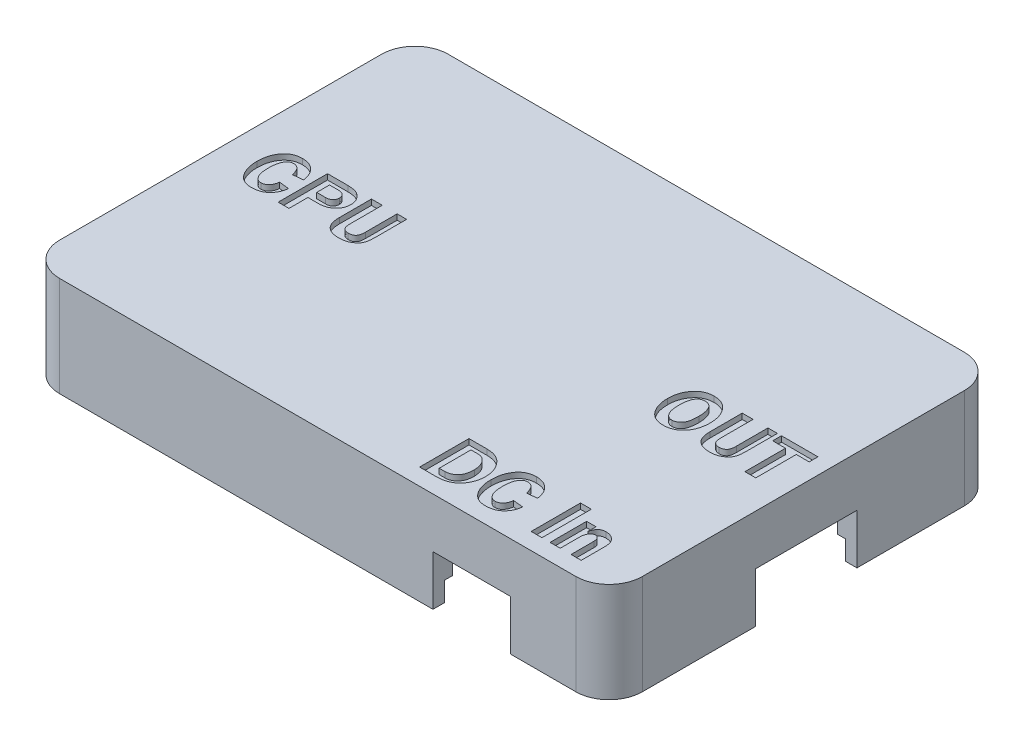
from build123d import *

# Parameters (mm, degrees)
SKETCH1_W           = 105
SKETCH1_H           = 70
BOSS_EXTRUDE1_DEPTH = 15
SKETCH3_W           = 98
SKETCH3_H           = 63
CUT_EXTRUDE1_DEPTH  = 12
FILLET1_R           = 6
SKETCH6_W           = 3.5
SKETCH6_H           = 18.3
SKETCH6_W_2         = 14
SKETCH6_H_2         = 3.5
SKETCH6_H_3         = 20
CUT_EXTRUDE3_DEPTH  = 26
CUT_EXTRUDE4_START  = -10
CUT_EXTRUDE4_DEPTH  = 10
BOSS_EXTRUDE3_DEPTH = 3
CUT_EXTRUDE5_DEPTH  = 3.5
SKETCH12_W          = 3.5
SKETCH12_H          = 18.3
SKETCH12_W_2        = 14
SKETCH12_H_2        = 3.5
SKETCH12_H_3        = 20
BOSS_EXTRUDE4_DEPTH = 6
SKETCH13_W          = 1.949036815
SKETCH13_H          = 8.892480469
CUT_EXTRUDE6_DEPTH  = 1


with BuildPart() as part:
    # Sketch1 → Boss-Extrude1 (new body)
    with BuildSketch(Plane(origin=(0, 0, 0), x_dir=(1, 0, 0), z_dir=(0, 1, 0))):
        Rectangle(SKETCH1_W, SKETCH1_H)
    extrude(amount=BOSS_EXTRUDE1_DEPTH)

    # Sketch3 → Cut-Extrude1 (cut)
    with BuildSketch(Plane(origin=(0, 15, 0), x_dir=(1, 0, 0), z_dir=(0, 1, 0))):
        Rectangle(SKETCH3_W, SKETCH3_H)
    extrude(amount=-CUT_EXTRUDE1_DEPTH, mode=Mode.SUBTRACT)

    # Fillet1
    fillet1_edges = [part.edges().sort_by_distance(p)[0] for p in [
        (-49, 9, 31.5),
        (-49, 9, -31.5),
        (49, 9, -31.5),
        (49, 9, 31.5),
        (52.5, 7.5, 35),
        (-52.5, 7.5, 35),
        (-52.5, 7.5, -35),
        (52.5, 7.5, -35),
    ]]
    fillet(fillet1_edges, radius=FILLET1_R)

    # Sketch6 → Cut-Extrude3 (cut)
    with BuildSketch(Plane(origin=(0, 15, 0), x_dir=(1, 0, 0), z_dir=(0, 1, 0))):
        with Locations((50.75, 0.51)):
            Rectangle(SKETCH6_W, SKETCH6_H)
        with Locations((27.76, -33.25)):
            Rectangle(SKETCH6_W_2, SKETCH6_H_2)
        with Locations((-50.75, 0)):
            Rectangle(SKETCH6_W, SKETCH6_H_3)
    extrude(amount=-CUT_EXTRUDE3_DEPTH, mode=Mode.SUBTRACT)

    # Sketch9 → Cut-Extrude4 (cut)
    with BuildSketch(Plane(origin=(0, 3, 0), x_dir=(1, 0, 0), z_dir=(0, 1, 0)).offset(CUT_EXTRUDE4_START)):
        with BuildLine():
            Line((-43, 31.5), (43, 31.5))
            ThreePointArc((43, 31.5), (47.242640687, 29.742640687), (49, 25.5))
            Line((49, 25.5), (49, -25.5))
            ThreePointArc((49, -25.5), (47.242640687, -29.742640687), (43, -31.5))
            Line((43, -31.5), (-43, -31.5))
            ThreePointArc((-43, -31.5), (-47.242640687, -29.742640687), (-49, -25.5))
            Line((-49, -25.5), (-49, 25.5))
            ThreePointArc((-49, 25.5), (-47.242640687, 29.742640687), (-43, 31.5))
        make_face()
    extrude(amount=CUT_EXTRUDE4_DEPTH, mode=Mode.SUBTRACT)


with BuildPart() as cut_extrude4_piece_1:
    # of the separate pieces the step leaves, piece 1, a body of its own (cut_extrude4_pieces)
    add(part.part.solids().sort_by_distance((-46.5, 0, -35))[0])

    # Sketch10 → Boss-Extrude3 (add)
    with BuildSketch(Plane(origin=(0, 15, 0), x_dir=(1, 0, 0), z_dir=(0, 1, 0))):
        with BuildLine():
            Line((-46.5, 35), (46.5, 35))
            ThreePointArc((46.5, 35), (50.742640687, 33.242640687), (52.5, 29))
            Line((52.5, 29), (52.5, -29))
            ThreePointArc((52.5, -29), (50.742640687, -33.242640687), (46.5, -35))
            Line((46.5, -35), (-46.5, -35))
            ThreePointArc((-46.5, -35), (-50.742640687, -33.242640687), (-52.5, -29))
            Line((-52.5, -29), (-52.5, 29))
            ThreePointArc((-52.5, 29), (-50.742640687, 33.242640687), (-46.5, 35))
        make_face()
    extrude(amount=BOSS_EXTRUDE3_DEPTH)


with BuildPart() as cut_extrude4_piece_2:
    # of the separate pieces the step leaves, piece 2, a body of its own (cut_extrude4_pieces)
    add(part.part.solids().sort_by_distance((-52.5, 0, 10))[0])


with BuildPart() as cut_extrude4_piece_3:
    # of the separate pieces the step leaves, piece 3, a body of its own (cut_extrude4_pieces)
    add(part.part.solids().sort_by_distance((49, 0, 8.64))[0])


with BuildPart() as cut_extrude5_tool:
    # Sketch11 → Cut-Extrude5 (new body)
    with BuildSketch(Plane(origin=(0, 0, 0), x_dir=(-1, 0, 0), z_dir=(0, -1, 0))):
        with BuildLine():
            Line((-44.4, 32.9), (44.4, 32.9))
            ThreePointArc((44.4, 32.9), (48.642640687, 31.142640687), (50.4, 26.9))
            Line((50.4, 26.9), (50.4, -26.9))
            ThreePointArc((50.4, -26.9), (48.642640687, -31.142640687), (44.4, -32.9))
            Line((44.4, -32.9), (-44.4, -32.9))
            ThreePointArc((-44.4, -32.9), (-48.642640687, -31.142640687), (-50.4, -26.9))
            Line((-50.4, -26.9), (-50.4, 26.9))
            ThreePointArc((-50.4, 26.9), (-48.642640687, 31.142640687), (-44.4, 32.9))
        make_face()
    extrude(amount=-CUT_EXTRUDE5_DEPTH)


with BuildPart() as cut_extrude4_piece_1_1:
    add(cut_extrude4_piece_1.part)

    # Cut-Extrude5: cut by cut_extrude5_tool
    add(cut_extrude5_tool.part, mode=Mode.SUBTRACT)



with BuildPart() as cut_extrude4_piece_2_1:
    add(cut_extrude4_piece_2.part)

    # Cut-Extrude5: cut by cut_extrude5_tool
    add(cut_extrude5_tool.part, mode=Mode.SUBTRACT)


with BuildPart() as cut_extrude4_piece_3_1:
    add(cut_extrude4_piece_3.part)

    # Cut-Extrude5: cut by cut_extrude5_tool
    add(cut_extrude5_tool.part, mode=Mode.SUBTRACT)


with BuildPart() as cut_extrude4_piece_1_2:
    add(cut_extrude4_piece_1_1.part)

    add(cut_extrude4_piece_2_1.part)  # Boss-Extrude4 merges Cut-Extrude4 piece 2

    add(cut_extrude4_piece_3_1.part)  # Boss-Extrude4 merges Cut-Extrude4 piece 3
    # Sketch12 → Boss-Extrude4 (add)
    with BuildSketch(Plane(origin=(0, 15, 0), x_dir=(-1, 0, 0), z_dir=(0, -1, 0))):
        with Locations((-50.75, 0.51)):
            Rectangle(SKETCH12_W, SKETCH12_H)
        with Locations((-27.76, -33.25)):
            Rectangle(SKETCH12_W_2, SKETCH12_H_2)
        with Locations((50.75, 0)):
            Rectangle(SKETCH12_W, SKETCH12_H_3)
    extrude(amount=BOSS_EXTRUDE4_DEPTH)

    # Sketch13 → Cut-Extrude6 (cut)
    # profile 1 of 10: a face of its own
    with BuildSketch(Plane(origin=(0, 18, 0), x_dir=(1, 0, 0), z_dir=(0, 1, 0))):
        with BuildLine():
            Line((-41.732830518, -0.163303105), (-39.917028641, -0.347928662))
            add(Edge.make_bspline(
                [(-39.917028641, -0.347928662), (-39.930917153, -0.462457061), (-39.958267714, -0.687997137), (-40.032669671, -1.015962513), (-40.125941255, -1.329682055), (-40.249006157, -1.62526642), (-40.39454952, -1.904547154), (-40.56156911, -2.169478809), (-40.758028769, -2.414563659), (-40.973277238, -2.645844177), (-41.213243183, -2.852206272), (-41.471426508, -3.03544519), (-41.751318919, -3.188356125), (-42.051270543, -3.311193555), (-42.369744507, -3.409093428), (-42.70739142, -3.47890595), (-43.064710699, -3.521653823), (-43.309321878, -3.526141638), (-43.434431019, -3.528436981)],
                knots=[0, 0, 0, 0, 1.051982192, 2.07166211, 3.064163433, 4.034902158, 4.987714795, 5.935166584, 6.887152378, 7.84950099, 8.813936601, 9.76952359, 10.733246651, 11.716896322, 12.722162435, 13.768923523, 14.858890826, 16, 16, 16, 16], degree=3))
            add(Edge.make_bspline(
                [(-43.434431019, -3.528436981), (-43.534732181, -3.52663117), (-43.730683014, -3.523103293), (-44.017260625, -3.494966954), (-44.288482465, -3.444281158), (-44.547091665, -3.379147308), (-44.789920324, -3.291038408), (-45.019446117, -3.186279485), (-45.23307208, -3.059675873), (-45.433501465, -2.914689034), (-45.618917592, -2.752340761), (-45.79410872, -2.577726971), (-45.956655035, -2.389407229), (-46.110753006, -2.188898721), (-46.249835335, -1.972936805), (-46.383522408, -1.746635103), (-46.499203107, -1.503835094), (-46.609270671, -1.251484992), (-46.702215045, -0.987358923), (-46.787514337, -0.717593866), (-46.855359809, -0.439402645), (-46.911850934, -0.155453199), (-46.958457647, 0.135192666), (-46.990201698, 0.431870317), (-47.009988286, 0.735441201), (-47.011816273, 0.939978141), (-47.012740796, 1.043424767)],
                knots=[0, 0, 0, 0, 1.105609578, 2.159946219, 3.169608684, 4.145018578, 5.096309205, 6.013193973, 6.922417586, 7.828974177, 8.736285872, 9.636371327, 10.553549476, 11.476787637, 12.421499323, 13.383578628, 14.372015653, 15.3840493, 16.417202389, 17.456939369, 18.501862101, 19.571742627, 20.648005113, 21.745532771, 22.859780399, 24, 24, 24, 24], degree=3))
            add(Edge.make_bspline(
                [(-47.012740796, 1.043424767), (-47.009932604, 1.207219444), (-47.004435413, 1.527856552), (-46.958042653, 1.997342331), (-46.881812604, 2.443684033), (-46.778760792, 2.86849661), (-46.640131777, 3.26881264), (-46.47618975, 3.648246316), (-46.275301654, 4.001305531), (-46.051605893, 4.332279318), (-45.798482326, 4.631074101), (-45.522259605, 4.894979009), (-45.219088123, 5.114582299), (-44.894333995, 5.294942801), (-44.547918429, 5.437692328), (-44.177139344, 5.53471243), (-43.784956584, 5.598557477), (-43.515268986, 5.604588413), (-43.377330331, 5.60767309)],
                knots=[0, 0, 0, 0, 1.198178484, 2.345500427, 3.447453775, 4.509103708, 5.539599216, 6.543499879, 7.528638035, 8.507148543, 9.462269331, 10.388250012, 11.295364851, 12.193024101, 13.10070884, 14.028537591, 14.991644863, 16, 16, 16, 16], degree=3))
            add(Edge.make_bspline(
                [(-43.377330331, 5.60767309), (-43.261729359, 5.605291777), (-43.035519123, 5.600631978), (-42.704593927, 5.558922333), (-42.389019283, 5.495287921), (-42.089197625, 5.404004265), (-41.805543882, 5.285197042), (-41.537573682, 5.139986285), (-41.285849643, 4.967463774), (-41.049073053, 4.771598492), (-40.831345208, 4.549881529), (-40.634737113, 4.303786455), (-40.461664548, 4.032853249), (-40.306662366, 3.741362563), (-40.174802034, 3.42530312), (-40.068364943, 3.085076327), (-39.976704918, 2.723267558), (-39.937225575, 2.471974286), (-39.917028641, 2.343417096)],
                knots=[0, 0, 0, 0, 1.053980237, 2.062449089, 3.037335328, 3.987379173, 4.915943175, 5.837774954, 6.762291017, 7.69511876, 8.636291522, 9.591555379, 10.562673013, 11.564478635, 12.599430281, 13.681008754, 14.813645119, 16, 16, 16, 16], degree=3))
            Line((-39.917028641, 2.343417096), (-41.719507024, 2.16830832))
            add(Edge.make_bspline(
                [(-41.719507024, 2.16830832), (-41.736745597, 2.243295967), (-41.770365768, 2.389543423), (-41.828054355, 2.600437285), (-41.896476854, 2.795914467), (-41.966482073, 2.978298982), (-42.047911885, 3.144645262), (-42.133057486, 3.298005699), (-42.225547815, 3.436523697), (-42.325614164, 3.560154242), (-42.432581609, 3.668512163), (-42.544805142, 3.765097336), (-42.665242989, 3.84509415), (-42.792428335, 3.910442221), (-42.925627517, 3.962085469), (-43.066096105, 3.998523334), (-43.21301588, 4.019324513), (-43.313186247, 4.022479846), (-43.364006837, 4.024080678)],
                knots=[0, 0, 0, 0, 1.364641525, 2.661443042, 3.874868095, 5.036638674, 6.123695894, 7.156520859, 8.145828854, 9.073718286, 9.972847736, 10.84306696, 11.695053518, 12.530457183, 13.374680603, 14.223466012, 15.098690498, 16, 16, 16, 16], degree=3))
            add(Edge.make_bspline(
                [(-43.364006837, 4.024080678), (-43.42065862, 4.021970895), (-43.532490648, 4.017806132), (-43.695947217, 3.982029648), (-43.852338294, 3.925026032), (-43.998896501, 3.841823648), (-44.138472783, 3.737079286), (-44.268888335, 3.609250764), (-44.391958259, 3.4585958), (-44.505695436, 3.285275317), (-44.609015513, 3.087959196), (-44.697538373, 2.866363635), (-44.77351781, 2.621293507), (-44.836270516, 2.352319635), (-44.882663061, 2.0583307), (-44.91644816, 1.740059625), (-44.937432299, 1.397727548), (-44.940372742, 1.161463576), (-44.94188918, 1.039618055)],
                knots=[0, 0, 0, 0, 0.726895696, 1.434910162, 2.138785806, 2.857458904, 3.590857252, 4.374590525, 5.196778853, 6.085005742, 7.032695212, 8.052607015, 9.145406711, 10.325446451, 11.59680084, 12.965544286, 14.435077357, 16, 16, 16, 16], degree=3))
            add(Edge.make_bspline(
                [(-44.94188918, 1.039618055), (-44.940578125, 0.915857434), (-44.938041018, 0.676360443), (-44.91441178, 0.330272506), (-44.879511011, 0.009235585), (-44.828554722, -0.286517707), (-44.76241344, -0.557671046), (-44.681612082, -0.803991335), (-44.584113346, -1.024302606), (-44.473945063, -1.219572559), (-44.351514645, -1.389711452), (-44.221270317, -1.536745034), (-44.087189078, -1.664095498), (-43.944110177, -1.765349665), (-43.797167205, -1.848088065), (-43.640910632, -1.90199032), (-43.479279519, -1.938755502), (-43.368657202, -1.942797103), (-43.312616218, -1.944844569)],
                knots=[0, 0, 0, 0, 1.578182673, 3.054040949, 4.422086023, 5.695161059, 6.87854739, 7.978818638, 8.996746236, 9.946184514, 10.833196196, 11.664422499, 12.448801434, 13.185309597, 13.895016738, 14.591171581, 15.286291109, 16, 16, 16, 16], degree=3))
            add(Edge.make_bspline(
                [(-43.312616218, -1.944844569), (-43.261779857, -1.943381015), (-43.160857469, -1.940475508), (-43.012690293, -1.917345105), (-42.869908081, -1.878604153), (-42.732950683, -1.825801984), (-42.601517568, -1.755926786), (-42.476839521, -1.670501033), (-42.357682166, -1.569750796), (-42.24384158, -1.456748463), (-42.139970504, -1.329363593), (-42.046375233, -1.191805045), (-41.963701534, -1.044248772), (-41.894446476, -0.886413172), (-41.8336842, -0.71968569), (-41.790401322, -0.542481149), (-41.751792821, -0.356818708), (-41.73925146, -0.22883061), (-41.732830518, -0.163303105)],
                knots=[0, 0, 0, 0, 0.929161302, 1.844608371, 2.733809141, 3.629943943, 4.52246771, 5.449091207, 6.387761928, 7.372056715, 8.377585556, 9.387853863, 10.410894549, 11.465029895, 12.536385021, 13.650531068, 14.797115969, 16, 16, 16, 16], degree=3))
        make_face()
    # profile 2 of 10: a face of its own
    with BuildSketch(Plane(origin=(0, 18, 0), x_dir=(1, 0, 0), z_dir=(0, 1, 0))):
        with BuildLine():
            Line((-36.780297517, -3.40662218), (-38.729334332, -3.40662218))
            Line((-38.729334332, -3.40662218), (-38.729334332, 5.485858289))
            Line((-38.729334332, 5.485858289), (-35.034919822, 5.485858289))
            add(Edge.make_bspline(
                [(-35.034919822, 5.485858289), (-34.900329644, 5.483291664), (-34.640097774, 5.478329063), (-34.263170573, 5.440549118), (-33.913759563, 5.375881986), (-33.590427465, 5.288054474), (-33.29537958, 5.170919097), (-33.026458728, 5.03080972), (-32.786431732, 4.861750281), (-32.575390422, 4.668259387), (-32.390752935, 4.459881724), (-32.228950298, 4.242751332), (-32.091332188, 4.019036297), (-31.980827182, 3.786253148), (-31.89127879, 3.548031598), (-31.832273656, 3.301081416), (-31.79104414, 3.047773742), (-31.787623769, 2.875893577), (-31.785890679, 2.788802462)],
                knots=[0, 0, 0, 0, 1.359773363, 2.629139583, 3.822342582, 4.946838289, 6.008686318, 7.023819875, 8.003792892, 8.965842641, 9.910259963, 10.812871024, 11.699009655, 12.559192182, 13.413045169, 14.265067297, 15.120915298, 16, 16, 16, 16], degree=3))
            add(Edge.make_bspline(
                [(-31.785890679, 2.788802462), (-31.788284608, 2.690310132), (-31.792969624, 2.497556685), (-31.834763372, 2.21455774), (-31.900030871, 1.944331099), (-31.994968217, 1.686961865), (-32.113812788, 1.441721632), (-32.265894407, 1.212721631), (-32.437852732, 0.992576503), (-32.63810002, 0.790198973), (-32.858414365, 0.605775697), (-33.096212559, 0.443201696), (-33.350871837, 0.308163623), (-33.620450405, 0.196713504), (-33.905131788, 0.108950017), (-34.206314183, 0.04965203), (-34.521816848, 0.009206231), (-34.737862033, 0.005889228), (-34.848390908, 0.004192247)],
                knots=[0, 0, 0, 0, 1.018665852, 1.993569996, 2.953750447, 3.890480617, 4.827118752, 5.766766339, 6.729569352, 7.713802092, 8.706559697, 9.698991611, 10.688814147, 11.683718633, 12.713787737, 13.765739752, 14.856950822, 16, 16, 16, 16], degree=3))
            Line((-34.848390908, 0.004192247), (-36.780297517, 0.004192247))
            Line((-36.780297517, 0.004192247), (-36.780297517, -3.40662218))
        make_face()
        with BuildLine():
            Line((-36.780297517, 1.587784659), (-35.200511817, 1.587784659))
            add(Edge.make_bspline(
                [(-35.200511817, 1.587784659), (-35.096161166, 1.590845836), (-34.898880973, 1.596633148), (-34.622545597, 1.655006664), (-34.386308533, 1.754258799), (-34.191154669, 1.893177938), (-34.040696971, 2.068052663), (-33.931083456, 2.270887131), (-33.867767733, 2.502115414), (-33.860502284, 2.664694578), (-33.856742295, 2.74883198)],
                knots=[0, 0, 0, 0, 1.241541437, 2.347196968, 3.342370143, 4.273487896, 5.173422332, 6.065966554, 6.999105747, 8, 8, 8, 8], degree=3))
            add(Edge.make_bspline(
                [(-33.856742295, 2.74883198), (-33.859973563, 2.826022998), (-33.866272025, 2.976485509), (-33.92842841, 3.193144344), (-34.028464557, 3.391434996), (-34.143651384, 3.540038643), (-34.255988454, 3.648202354), (-34.362111828, 3.715728634), (-34.484275202, 3.772347313), (-34.621696941, 3.823440974), (-34.77825575, 3.856926834), (-34.950334664, 3.884435134), (-35.139370335, 3.89871296), (-35.270917626, 3.901048833), (-35.339456825, 3.902265877)],
                knots=[0, 0, 0, 0, 1.294039653, 2.522371889, 3.752136745, 5.005688589, 5.661752901, 6.36236276, 7.106073407, 7.921965867, 8.819093097, 9.789867873, 10.848469742, 12, 12, 12, 12], degree=3))
            Line((-35.339456825, 3.902265877), (-36.780297517, 3.902265877))
            Line((-36.780297517, 3.902265877), (-36.780297517, 1.587784659))
        make_face(mode=Mode.SUBTRACT)
    # profile 3 of 10: a face of its own
    with BuildSketch(Plane(origin=(0, 18, 0), x_dir=(1, 0, 0), z_dir=(0, 1, 0))):
        with BuildLine():
            Line((-24.477002622, 5.485858289), (-24.477002622, -0.18614338))
            add(Edge.make_bspline(
                [(-24.477002622, -0.18614338), (-24.477741403, -0.277513396), (-24.479178532, -0.455252924), (-24.490052633, -0.71435412), (-24.511119023, -0.957486067), (-24.539560185, -1.185464326), (-24.575327961, -1.397646505), (-24.617957673, -1.594510543), (-24.672394661, -1.77459257), (-24.732595119, -1.942049036), (-24.806409808, -2.099803377), (-24.895916912, -2.25054975), (-25.004005413, -2.395114638), (-25.125586346, -2.536888256), (-25.265969774, -2.672143742), (-25.422396894, -2.802906112), (-25.593864999, -2.931147781), (-25.781482394, -3.051861033), (-25.98156498, -3.164224985), (-26.195019602, -3.261529071), (-26.41849019, -3.345731445), (-26.654560892, -3.411222912), (-26.899522285, -3.465762767), (-27.156803038, -3.50033579), (-27.424208786, -3.524394485), (-27.60669801, -3.527075358), (-27.699384778, -3.528436981)],
                knots=[0, 0, 0, 0, 1.232909519, 2.398344302, 3.498197176, 4.525023179, 5.49755951, 6.401064252, 7.240745329, 8.0343409, 8.800303383, 9.58726796, 10.39545972, 11.233043339, 12.104842021, 13.022312987, 13.98286845, 14.992091959, 16.030663636, 17.076443674, 18.154591772, 19.249401951, 20.379492449, 21.538147082, 22.749618276, 24, 24, 24, 24], degree=3))
            add(Edge.make_bspline(
                [(-27.699384778, -3.528436981), (-27.787615712, -3.527580763), (-27.960487633, -3.525903164), (-28.213879165, -3.505710903), (-28.456209268, -3.476449577), (-28.686165609, -3.432320086), (-28.905133189, -3.3773809), (-29.111754964, -3.309016847), (-29.307441888, -3.229092173), (-29.490174312, -3.136094501), (-29.659374052, -3.030340747), (-29.818468495, -2.918215263), (-29.965302836, -2.796510842), (-30.099208786, -2.664838602), (-30.219468435, -2.522896512), (-30.328054662, -2.372938781), (-30.423712463, -2.213522808), (-30.508073306, -2.045052565), (-30.580123734, -1.866030613), (-30.640768652, -1.67542625), (-30.694029198, -1.47417429), (-30.738083779, -1.261414004), (-30.769173208, -1.036819269), (-30.794980727, -0.802081454), (-30.807191665, -0.55488566), (-30.809954969, -0.386638764), (-30.811372271, -0.300344756)],
                knots=[0, 0, 0, 0, 1.232927142, 2.415688846, 3.550816513, 4.643046955, 5.686186614, 6.704144379, 7.682352101, 8.638155303, 9.56594428, 10.468992341, 11.356891567, 12.228522285, 13.090353992, 13.954236325, 14.813509306, 15.685996709, 16.585117507, 17.50776422, 18.480004747, 19.493937418, 20.542378439, 21.648026349, 22.79367027, 24, 24, 24, 24], degree=3))
            Line((-30.811372271, -0.300344756), (-30.811372271, 5.485858289))
            Line((-30.811372271, 5.485858289), (-28.862335456, 5.485858289))
            Line((-28.862335456, 5.485858289), (-28.862335456, -0.205176943))
            add(Edge.make_bspline(
                [(-28.862335456, -0.205176943), (-28.861546891, -0.294674904), (-28.860046021, -0.465015718), (-28.840590718, -0.707784768), (-28.810764574, -0.925274724), (-28.770651113, -1.118260743), (-28.715228073, -1.285406559), (-28.649365022, -1.428427242), (-28.5700854, -1.54693481), (-28.445960354, -1.665174178), (-28.275579665, -1.776262538), (-28.057789208, -1.872047073), (-27.82786451, -1.935055278), (-27.669340603, -1.941551732), (-27.588990115, -1.944844569)],
                knots=[0, 0, 0, 0, 1.299600879, 2.473520833, 3.534320362, 4.486853006, 5.331918955, 6.08625075, 6.768716594, 7.387765943, 8.563420649, 9.70209071, 10.835266329, 12, 12, 12, 12], degree=3))
            add(Edge.make_bspline(
                [(-27.588990115, -1.944844569), (-27.486514257, -1.940539687), (-27.290740938, -1.932315496), (-27.012148006, -1.867874997), (-26.768713164, -1.754942932), (-26.588648911, -1.627830029), (-26.468664192, -1.49539878), (-26.390373421, -1.373999959), (-26.325916981, -1.230631372), (-26.273439468, -1.06637421), (-26.232217497, -0.880945671), (-26.201865937, -0.674900922), (-26.185438347, -0.44717332), (-26.183450292, -0.288315713), (-26.182409835, -0.205176943)],
                knots=[0, 0, 0, 0, 1.426096576, 2.724462796, 3.949706858, 5.144025048, 5.763171594, 6.427135233, 7.146488684, 7.9453966, 8.823982192, 9.788384409, 10.842542056, 12, 12, 12, 12], degree=3))
            Line((-26.182409835, -0.205176943), (-26.182409835, 5.485858289))
            Line((-26.182409835, 5.485858289), (-24.477002622, 5.485858289))
        make_face()
    # profile 4 of 10: a face of its own
    with BuildSketch(Plane(origin=(0, 18, 0), x_dir=(1, 0, 0), z_dir=(0, 1, 0))):
        with BuildLine():
            Line((15.352703607, -32), (15.352703607, -23.107519531))
            Line((15.352703607, -23.107519531), (18.647413301, -23.107519531))
            add(Edge.make_bspline(
                [(18.647413301, -23.107519531), (18.802413203, -23.111545781), (19.105405802, -23.119416264), (19.5470479, -23.180675204), (19.963375307, -23.284186706), (20.356201093, -23.42638791), (20.723615817, -23.612675733), (21.067252603, -23.838495096), (21.384429891, -24.10718032), (21.673706954, -24.412992982), (21.932643599, -24.746909549), (22.16057064, -25.100161603), (22.352923429, -25.470653946), (22.512722367, -25.857336193), (22.634339177, -26.261731167), (22.718579034, -26.683100658), (22.77465444, -27.120191871), (22.780458323, -27.417808977), (22.783406464, -27.568986616)],
                knots=[0, 0, 0, 0, 1.090662008, 2.132017583, 3.13055926, 4.105304072, 5.065861442, 6.023216668, 6.9928956, 7.984674896, 8.98061724, 9.962861141, 10.939516749, 11.914701274, 12.903561049, 13.906287412, 14.936477377, 16, 16, 16, 16], degree=3))
            add(Edge.make_bspline(
                [(22.783406464, -27.568986616), (22.78059121, -27.720175823), (22.775047476, -28.017894101), (22.717016285, -28.455154946), (22.628874984, -28.87588054), (22.502690709, -29.279373152), (22.34035318, -29.664693525), (22.143059376, -30.033623087), (21.907990287, -30.383333719), (21.640797341, -30.71476107), (21.339382001, -31.018869099), (21.000592414, -31.282167242), (20.629786477, -31.504819062), (20.226260999, -31.685871172), (19.790791483, -31.829092571), (19.322413776, -31.928697445), (18.822142994, -31.987940498), (18.478181115, -31.99589998), (18.301002461, -32)],
                knots=[0, 0, 0, 0, 1.020254704, 2.009061887, 2.972747181, 3.919798743, 4.85859884, 5.791949185, 6.740046485, 7.699418685, 8.662656393, 9.624092132, 10.588690998, 11.576040304, 12.604214078, 13.678002476, 14.803912809, 16, 16, 16, 16], degree=3))
            Line((18.301002461, -32), (15.352703607, -32))
        make_face()
        with BuildLine():
            Line((17.301740422, -30.416407588), (18.348586367, -30.416407588))
            add(Edge.make_bspline(
                [(18.348586367, -30.416407588), (18.429290425, -30.414295378), (18.588273176, -30.410134436), (18.821705102, -30.374725794), (19.045866115, -30.318101596), (19.260014514, -30.236428797), (19.467215445, -30.137026829), (19.661486626, -30.008417368), (19.849781477, -29.861995001), (20.026290173, -29.690714773), (20.188147552, -29.496928866), (20.33098843, -29.279984311), (20.447669618, -29.038560523), (20.545537916, -28.775472868), (20.621075279, -28.489883072), (20.673449836, -28.180902299), (20.706051097, -27.850112657), (20.710346085, -27.621724547), (20.712554848, -27.504272503)],
                knots=[0, 0, 0, 0, 0.916438432, 1.805335536, 2.675954657, 3.538148476, 4.405299458, 5.281006048, 6.179350956, 7.112196798, 8.06923501, 9.042850272, 10.055056242, 11.108757989, 12.227742205, 13.405651178, 14.665816834, 16, 16, 16, 16], degree=3))
            add(Edge.make_bspline(
                [(20.712554848, -27.504272503), (20.710810091, -27.407130106), (20.707392532, -27.216851504), (20.678065098, -26.93691312), (20.63046067, -26.669294846), (20.566878159, -26.412020782), (20.47969808, -26.168417572), (20.377925243, -25.934154081), (20.252728954, -25.713719656), (20.113602944, -25.50513399), (19.958674531, -25.31447484), (19.788485875, -25.149113823), (19.609056068, -25.0052024), (19.415217056, -24.891746028), (19.211634982, -24.79978187), (18.994791742, -24.738196291), (18.766857495, -24.698732045), (18.610782763, -24.693682965), (18.531308569, -24.691111943)],
                knots=[0, 0, 0, 0, 1.17395932, 2.299504067, 3.397675928, 4.457863975, 5.498370802, 6.521522045, 7.541247468, 8.557940523, 9.549685283, 10.504140474, 11.42158539, 12.322503077, 13.211725158, 14.114501384, 15.039892734, 16, 16, 16, 16], degree=3))
            Line((18.531308569, -24.691111943), (17.301740422, -24.691111943))
            Line((17.301740422, -24.691111943), (17.301740422, -30.416407588))
        make_face(mode=Mode.SUBTRACT)
    # profile 5 of 10: a face of its own
    with BuildSketch(Plane(origin=(0, 18, 0), x_dir=(1, 0, 0), z_dir=(0, 1, 0))):
        with BuildLine():
            Line((29.03783515, -28.756680925), (30.853637026, -28.941306483))
            add(Edge.make_bspline(
                [(30.853637026, -28.941306483), (30.839748515, -29.055834881), (30.812397953, -29.281374957), (30.737995996, -29.609340333), (30.644724413, -29.923059875), (30.521659511, -30.21864424), (30.376116147, -30.497924975), (30.209096558, -30.762856629), (30.012636899, -31.007941479), (29.797388429, -31.239221997), (29.557422485, -31.445584092), (29.29923916, -31.62882301), (29.019346749, -31.781733946), (28.719395125, -31.904571375), (28.400921161, -32.002471248), (28.063274248, -32.07228377), (27.705954969, -32.115031643), (27.46134379, -32.119519458), (27.336234649, -32.121814801)],
                knots=[0, 0, 0, 0, 1.051982192, 2.07166211, 3.064163433, 4.034902158, 4.987714795, 5.935166584, 6.887152378, 7.84950099, 8.813936601, 9.76952359, 10.733246651, 11.716896322, 12.722162435, 13.768923523, 14.858890826, 16, 16, 16, 16], degree=3))
            add(Edge.make_bspline(
                [(27.336234649, -32.121814801), (27.235933486, -32.12000899), (27.039982654, -32.116481113), (26.753405043, -32.088344775), (26.482183203, -32.037658978), (26.223574002, -31.972525128), (25.980745343, -31.884416228), (25.751219551, -31.779657305), (25.537593588, -31.653053693), (25.337164203, -31.508066855), (25.151748076, -31.345718581), (24.976556947, -31.171104791), (24.814010633, -30.98278505), (24.659912661, -30.782276541), (24.520830333, -30.566314625), (24.38714326, -30.340012924), (24.271462561, -30.097212914), (24.161394997, -29.844862812), (24.068450623, -29.580736743), (23.98315133, -29.310971687), (23.915305859, -29.032780465), (23.858814734, -28.748831019), (23.81220802, -28.458185155), (23.78046397, -28.161507503), (23.760677381, -27.857936619), (23.758849394, -27.653399679), (23.757924872, -27.549953053)],
                knots=[0, 0, 0, 0, 1.105609578, 2.159946219, 3.169608684, 4.145018578, 5.096309205, 6.013193973, 6.922417586, 7.828974177, 8.736285872, 9.636371327, 10.553549476, 11.476787637, 12.421499323, 13.383578628, 14.372015653, 15.3840493, 16.417202389, 17.456939369, 18.501862101, 19.571742627, 20.648005113, 21.745532771, 22.859780399, 24, 24, 24, 24], degree=3))
            add(Edge.make_bspline(
                [(23.757924872, -27.549953053), (23.760733064, -27.386158376), (23.766230254, -27.065521268), (23.812623015, -26.596035489), (23.888853063, -26.149693787), (23.991904876, -25.72488121), (24.130533891, -25.32456518), (24.294475918, -24.945131504), (24.495364014, -24.59207229), (24.719059775, -24.261098503), (24.972183342, -23.96230372), (25.248406063, -23.698398811), (25.551577544, -23.478795521), (25.876331673, -23.298435019), (26.222747239, -23.155685492), (26.593526323, -23.05866539), (26.985709084, -22.994820343), (27.255396681, -22.988789407), (27.393335337, -22.98570473)],
                knots=[0, 0, 0, 0, 1.198178484, 2.345500427, 3.447453775, 4.509103708, 5.539599216, 6.543499879, 7.528638035, 8.507148543, 9.462269331, 10.388250012, 11.295364851, 12.193024101, 13.10070884, 14.028537591, 14.991644863, 16, 16, 16, 16], degree=3))
            add(Edge.make_bspline(
                [(27.393335337, -22.98570473), (27.508936309, -22.988086043), (27.735146544, -22.992745842), (28.066071741, -23.034455487), (28.381646385, -23.098089899), (28.681468042, -23.189373555), (28.965121786, -23.308180778), (29.233091986, -23.453391535), (29.484816025, -23.625914046), (29.721592615, -23.821779328), (29.93932046, -24.043496291), (30.135928554, -24.289591365), (30.30900112, -24.560524571), (30.464003301, -24.852015257), (30.595863634, -25.1680747), (30.702300725, -25.508301494), (30.79396075, -25.870110262), (30.833440093, -26.121403534), (30.853637026, -26.249960724)],
                knots=[0, 0, 0, 0, 1.053980237, 2.062449089, 3.037335328, 3.987379173, 4.915943175, 5.837774954, 6.762291017, 7.69511876, 8.636291522, 9.591555379, 10.562673013, 11.564478635, 12.599430281, 13.681008754, 14.813645119, 16, 16, 16, 16], degree=3))
            Line((30.853637026, -26.249960724), (29.051158644, -26.425069501))
            add(Edge.make_bspline(
                [(29.051158644, -26.425069501), (29.03392007, -26.350081853), (29.0002999, -26.203834397), (28.942611313, -25.992940535), (28.874188813, -25.797463353), (28.804183595, -25.615078838), (28.722753783, -25.448732558), (28.637608182, -25.295372121), (28.545117853, -25.156854123), (28.445051504, -25.033223579), (28.338084059, -24.924865657), (28.225860526, -24.828280484), (28.105422679, -24.74828367), (27.978237333, -24.682935599), (27.845038151, -24.631292352), (27.704569563, -24.594854487), (27.557649788, -24.574053307), (27.45747942, -24.570897974), (27.406658831, -24.569297143)],
                knots=[0, 0, 0, 0, 1.364641525, 2.661443042, 3.874868095, 5.036638674, 6.123695894, 7.156520859, 8.145828854, 9.073718286, 9.972847736, 10.84306696, 11.695053518, 12.530457183, 13.374680603, 14.223466012, 15.098690498, 16, 16, 16, 16], degree=3))
            add(Edge.make_bspline(
                [(27.406658831, -24.569297143), (27.350007048, -24.571406925), (27.23817502, -24.575571688), (27.074718451, -24.611348172), (26.918327374, -24.668351789), (26.771769167, -24.751554172), (26.632192885, -24.856298534), (26.501777333, -24.984127057), (26.378707409, -25.13478202), (26.264970232, -25.308102503), (26.161650155, -25.505418624), (26.073127295, -25.727014185), (25.997147857, -25.972084313), (25.934395151, -26.241058185), (25.888002607, -26.53504712), (25.854217508, -26.853318195), (25.833233369, -27.195650272), (25.830292926, -27.431914244), (25.828776488, -27.553759766)],
                knots=[0, 0, 0, 0, 0.726895696, 1.434910162, 2.138785806, 2.857458904, 3.590857252, 4.374590525, 5.196778853, 6.085005742, 7.032695212, 8.052607015, 9.145406711, 10.325446451, 11.59680084, 12.965544286, 14.435077357, 16, 16, 16, 16], degree=3))
            add(Edge.make_bspline(
                [(25.828776488, -27.553759766), (25.830087543, -27.677520386), (25.83262465, -27.917017377), (25.856253888, -28.263105314), (25.891154657, -28.584142236), (25.942110946, -28.879895527), (26.008252228, -29.151048866), (26.089053586, -29.397369155), (26.186552322, -29.617680427), (26.296720605, -29.812950379), (26.419151023, -29.983089272), (26.549395351, -30.130122854), (26.68347659, -30.257473318), (26.826555491, -30.358727486), (26.973498462, -30.441465885), (27.129755035, -30.49536814), (27.291386149, -30.532133322), (27.402008466, -30.536174924), (27.45804945, -30.538222389)],
                knots=[0, 0, 0, 0, 1.578182673, 3.054040949, 4.422086023, 5.695161059, 6.87854739, 7.978818638, 8.996746236, 9.946184514, 10.833196196, 11.664422499, 12.448801434, 13.185309597, 13.895016738, 14.591171581, 15.286291109, 16, 16, 16, 16], degree=3))
            add(Edge.make_bspline(
                [(27.45804945, -30.538222389), (27.508885811, -30.536758835), (27.609808199, -30.533853328), (27.757975375, -30.510722926), (27.900757587, -30.471981973), (28.037714984, -30.419179804), (28.1691481, -30.349304606), (28.293826147, -30.263878853), (28.412983502, -30.163128616), (28.526824088, -30.050126283), (28.630695164, -29.922741413), (28.724290435, -29.785182866), (28.806964134, -29.637626592), (28.876219192, -29.479790992), (28.936981467, -29.31306351), (28.980264345, -29.135858969), (29.018872847, -28.950196528), (29.031414208, -28.822208431), (29.03783515, -28.756680925)],
                knots=[0, 0, 0, 0, 0.929161302, 1.844608371, 2.733809141, 3.629943943, 4.52246771, 5.449091207, 6.387761928, 7.372056715, 8.377585556, 9.387853863, 10.410894549, 11.465029895, 12.536385021, 13.650531068, 14.797115969, 16, 16, 16, 16], degree=3))
        make_face()
    # profile 6 of 10: a face of its own
    with BuildSketch(Plane(origin=(0, 18, 0), x_dir=(1, 0, 0), z_dir=(0, 1, 0))):
        with Locations((36.42666417, -27.553759766)):
            Rectangle(SKETCH13_W, SKETCH13_H)
    # profile 7 of 10: a face of its own
    with BuildSketch(Plane(origin=(0, 18, 0), x_dir=(1, 0, 0), z_dir=(0, 1, 0))):
        with BuildLine():
            Line((44.466441032, -32), (42.639219018, -32))
            Line((42.639219018, -32), (42.639219018, -27.905880675))
            add(Edge.make_bspline(
                [(42.639219018, -27.905880675), (42.636921992, -27.8148985), (42.632611954, -27.644183501), (42.585069444, -27.406857251), (42.508146047, -27.205204211), (42.397884862, -27.043055742), (42.267578265, -26.917842542), (42.124103081, -26.828534839), (41.969065354, -26.770598856), (41.860617921, -26.764871749), (41.805548974, -26.76196356)],
                knots=[0, 0, 0, 0, 1.376160093, 2.582166986, 3.647364909, 4.622755064, 5.526615688, 6.363821952, 7.169158732, 8, 8, 8, 8], degree=3))
            add(Edge.make_bspline(
                [(41.805548974, -26.76196356), (41.739998255, -26.767176347), (41.605142408, -26.777900483), (41.409583094, -26.868124559), (41.221875917, -27.00950089), (41.074702879, -27.164906657), (40.960760236, -27.314062796), (40.890876799, -27.451320803), (40.826265695, -27.601858391), (40.77838714, -27.771743428), (40.738376982, -27.957286929), (40.710402063, -28.160238766), (40.693143627, -28.379513222), (40.691192934, -28.5314158), (40.690182202, -28.610122493)],
                knots=[0, 0, 0, 0, 0.986475648, 2.029451579, 3.194618528, 4.52282298, 5.249123319, 6.020716581, 6.841040592, 7.720244241, 8.680547509, 9.706304989, 10.81154652, 12, 12, 12, 12], degree=3))
            Line((40.690182202, -28.610122493), (40.690182202, -32))
            Line((40.690182202, -32), (38.862960188, -32))
            Line((38.862960188, -32), (38.862960188, -25.422000749))
            Line((38.862960188, -25.422000749), (40.564560689, -25.422000749))
            Line((40.564560689, -25.422000749), (40.564560689, -26.897101854))
            add(Edge.make_bspline(
                [(40.564560689, -26.897101854), (40.579668544, -26.83219246), (40.609065513, -26.705891312), (40.664476927, -26.524739459), (40.727484424, -26.35631661), (40.797360878, -26.200172915), (40.875698007, -26.056328284), (40.961976917, -25.925403077), (41.051764572, -25.803639037), (41.154503436, -25.699528422), (41.261346079, -25.605134971), (41.375921852, -25.521985126), (41.500261852, -25.454681545), (41.630185282, -25.396340777), (41.768143401, -25.352512946), (41.913068719, -25.323089738), (42.065094166, -25.302613796), (42.169017957, -25.30100968), (42.222383996, -25.300185948)],
                knots=[0, 0, 0, 0, 1.267660028, 2.466621654, 3.601080754, 4.686979916, 5.718730116, 6.71308556, 7.669117433, 8.591089876, 9.489287681, 10.380319333, 11.277218461, 12.174361233, 13.086722501, 14.024209804, 14.985409455, 16, 16, 16, 16], degree=3))
            add(Edge.make_bspline(
                [(42.222383996, -25.300185948), (42.299853569, -25.302163395), (42.452714967, -25.306065253), (42.677104872, -25.332412774), (42.891560418, -25.378667648), (43.096922063, -25.441577857), (43.293207074, -25.522789024), (43.478825423, -25.625588338), (43.656041977, -25.742938417), (43.822894231, -25.878802941), (43.977179668, -26.034370071), (44.108600503, -26.217348953), (44.218972547, -26.423229262), (44.311123217, -26.651474054), (44.380263957, -26.904637693), (44.431287745, -27.180892418), (44.461854476, -27.480745201), (44.464877467, -27.688190351), (44.466441032, -27.795486011)],
                knots=[0, 0, 0, 0, 0.973350212, 1.920594988, 2.833681207, 3.726285566, 4.616037691, 5.49717772, 6.38817882, 7.28334242, 8.196567818, 9.132542298, 10.102753717, 11.125636193, 12.218441832, 13.39419033, 14.652212062, 16, 16, 16, 16], degree=3))
            Line((44.466441032, -27.795486011), (44.466441032, -32))
        make_face()
    # profile 8 of 10: a face of its own
    with BuildSketch(Plane(origin=(0, 18, 0), x_dir=(1, 0, 0), z_dir=(0, 1, 0))):
        with BuildLine():
            add(Edge.make_bspline(
                [(30.72925762, -3.528436981), (30.584974609, -3.524704253), (30.30322506, -3.517415146), (29.893752477, -3.452155506), (29.507966284, -3.3517844), (29.149156525, -3.202270395), (28.813192753, -3.015574592), (28.503436199, -2.785315565), (28.218678149, -2.513433131), (27.962349187, -2.201989015), (27.734866916, -1.860409752), (27.532209113, -1.499394713), (27.366649613, -1.116910442), (27.225160896, -0.717657888), (27.120624548, -0.297201539), (27.041809345, 0.140695093), (26.99570112, 0.598318355), (26.990110897, 0.909452243), (26.987259204, 1.068168399)],
                knots=[0, 0, 0, 0, 1.039599213, 2.030083839, 2.982134293, 3.907219666, 4.824707676, 5.74691592, 6.681979156, 7.656565762, 8.648696834, 9.637712126, 10.637229113, 11.649911205, 12.688362501, 13.757051954, 14.855823476, 16, 16, 16, 16], degree=3))
            add(Edge.make_bspline(
                [(26.987259204, 1.068168399), (26.990813957, 1.224986572), (26.997810497, 1.533639478), (27.045074295, 1.987018439), (27.127182004, 2.421058544), (27.241479095, 2.835602989), (27.387713973, 3.231837444), (27.570099797, 3.607291635), (27.781550422, 3.965792167), (28.025731038, 4.300368654), (28.296029694, 4.606326725), (28.589942637, 4.875089996), (28.906612537, 5.101231377), (29.243370477, 5.28773087), (29.60298372, 5.431136879), (29.982925298, 5.533625101), (30.383978626, 5.595807458), (30.657975149, 5.603664257), (30.797778446, 5.60767309)],
                knots=[0, 0, 0, 0, 1.134637075, 2.233217125, 3.293820626, 4.327364149, 5.341237955, 6.345253085, 7.343542727, 8.348984134, 9.337515505, 10.292939359, 11.224157764, 12.146690851, 13.071608, 14.018179043, 14.988800656, 16, 16, 16, 16], degree=3))
            add(Edge.make_bspline(
                [(30.797778446, 5.60767309), (30.945849368, 5.603907404), (31.235136567, 5.596550357), (31.656124306, 5.531672049), (32.052982626, 5.429865177), (32.42534711, 5.285331613), (32.770133963, 5.094477083), (33.090013311, 4.864321903), (33.38628709, 4.594320397), (33.649421446, 4.281549224), (33.885517999, 3.94195784), (34.09468526, 3.583025513), (34.270339348, 3.20448145), (34.412459825, 2.807192553), (34.525534063, 2.393072167), (34.604858099, 1.960784102), (34.653607668, 1.510876316), (34.658901764, 1.204700828), (34.661591663, 1.049134836)],
                knots=[0, 0, 0, 0, 1.058532583, 2.068062531, 3.03886663, 3.984384552, 4.916621343, 5.849829607, 6.797360046, 7.77588671, 8.766648438, 9.752816314, 10.743598827, 11.74699039, 12.767486479, 13.810635302, 14.887596476, 16, 16, 16, 16], degree=3))
            add(Edge.make_bspline(
                [(34.661591663, 1.049134836), (34.658358046, 0.885308416), (34.65203838, 0.565131926), (34.600980532, 0.096295888), (34.520918656, -0.350391695), (34.403548986, -0.774744021), (34.256554196, -1.177783938), (34.071728765, -1.556764833), (33.8564073, -1.913955661), (33.610272451, -2.24645551), (33.335287432, -2.546972644), (33.03467763, -2.810431202), (32.708787445, -3.032883416), (32.35836128, -3.214391214), (31.984620165, -3.355742438), (31.587702737, -3.45705763), (31.16626692, -3.516100715), (30.877272291, -3.524258698), (30.72925762, -3.528436981)],
                knots=[0, 0, 0, 0, 1.1580871, 2.26332396, 3.330619845, 4.36341896, 5.372565307, 6.359685032, 7.339828269, 8.317782434, 9.279803142, 10.214546408, 11.137787035, 12.062748036, 12.998384325, 13.956936771, 14.953602242, 16, 16, 16, 16], degree=3))
        make_face()
        with BuildLine():
            add(Edge.make_bspline(
                [(30.74448447, -1.944844569), (30.807438818, -1.943276685), (30.931576723, -1.940185019), (31.11393745, -1.90771282), (31.29006705, -1.859263611), (31.458281846, -1.787686607), (31.61901878, -1.697634967), (31.772773921, -1.588486853), (31.917461266, -1.456947494), (32.058555136, -1.307251431), (32.185276409, -1.127147729), (32.296914494, -0.915466591), (32.385783284, -0.667430829), (32.461664912, -0.387439036), (32.519934684, -0.073584473), (32.560144775, 0.274267302), (32.587919356, 0.655962146), (32.58977541, 0.922189906), (32.590740047, 1.060554973)],
                knots=[0, 0, 0, 0, 0.759336547, 1.497314367, 2.229664932, 2.960932997, 3.698274424, 4.450740761, 5.231941405, 6.055913687, 6.929490506, 7.882082317, 8.936452772, 10.103461589, 11.381997983, 12.786321787, 14.329772955, 16, 16, 16, 16], degree=3))
            add(Edge.make_bspline(
                [(32.590740047, 1.060554973), (32.589229224, 1.174791611), (32.586288881, 1.397117344), (32.565007152, 1.720387961), (32.531842358, 2.024287456), (32.482405907, 2.307723541), (32.419685892, 2.571586419), (32.344368318, 2.816461797), (32.252998131, 3.041117339), (32.148714079, 3.246506543), (32.029261231, 3.429506047), (31.895456546, 3.589795104), (31.745697172, 3.724767123), (31.579776912, 3.834145255), (31.399965754, 3.920469985), (31.205187236, 3.981516887), (30.995868831, 4.018451271), (30.85122851, 4.022168795), (30.776841527, 4.024080678)],
                knots=[0, 0, 0, 0, 1.402008333, 2.728568858, 3.974612556, 5.152409489, 6.257314975, 7.301587928, 8.293568993, 9.230408436, 10.124559608, 10.970051344, 11.78616594, 12.589587933, 13.401120195, 14.226139399, 15.087722299, 16, 16, 16, 16], degree=3))
            add(Edge.make_bspline(
                [(30.776841527, 4.024080678), (30.707516871, 4.022144928), (30.571679057, 4.018351934), (30.375243627, 3.981168963), (30.192017836, 3.92215307), (30.022866709, 3.839425199), (29.866516713, 3.733747865), (29.725337944, 3.602551283), (29.596518483, 3.448641172), (29.482846225, 3.270226054), (29.38199976, 3.069167315), (29.294803164, 2.845347378), (29.220885151, 2.598335554), (29.160034469, 2.328104589), (29.11610485, 2.033403989), (29.080958528, 1.716040455), (29.063290109, 1.374806156), (29.059873425, 1.139876884), (29.05811082, 1.018681136)],
                knots=[0, 0, 0, 0, 0.854930696, 1.675189225, 2.457795313, 3.22484706, 3.991618898, 4.778679417, 5.595904034, 6.462661834, 7.383792682, 8.368358357, 9.423787974, 10.563755351, 11.784371404, 13.099814529, 14.503846941, 16, 16, 16, 16], degree=3))
            add(Edge.make_bspline(
                [(29.05811082, 1.018681136), (29.059646363, 0.896202269), (29.062616382, 0.659305879), (29.083235577, 0.31625154), (29.118389086, -0.001612147), (29.170114284, -0.29451126), (29.234147821, -0.563001914), (29.310811796, -0.807615854), (29.404646859, -1.026948338), (29.512814906, -1.221337835), (29.633388688, -1.391901466), (29.763101961, -1.539832201), (29.902722873, -1.665127678), (30.052957836, -1.766569305), (30.211341277, -1.848510219), (30.38139397, -1.902592085), (30.559596027, -1.938791989), (30.682122958, -1.942803078), (30.74448447, -1.944844569)],
                knots=[0, 0, 0, 0, 1.544640952, 2.987616354, 4.332504632, 5.575666337, 6.736229778, 7.811693995, 8.804570049, 9.739525736, 10.612030705, 11.434017709, 12.216130882, 12.970703651, 13.715024757, 14.456415453, 15.214374631, 16, 16, 16, 16], degree=3))
        make_face(mode=Mode.SUBTRACT)
    # profile 9 of 10: a face of its own
    with BuildSketch(Plane(origin=(0, 18, 0), x_dir=(1, 0, 0), z_dir=(0, 1, 0))):
        with BuildLine():
            Line((42.335924122, 5.485858289), (42.335924122, -0.18614338))
            add(Edge.make_bspline(
                [(42.335924122, -0.18614338), (42.335185342, -0.277513396), (42.333748212, -0.455252924), (42.322874111, -0.71435412), (42.301807722, -0.957486067), (42.27336656, -1.185464326), (42.237598784, -1.397646505), (42.194969072, -1.594510543), (42.140532084, -1.77459257), (42.080331626, -1.942049036), (42.006516937, -2.099803377), (41.917009832, -2.25054975), (41.808921332, -2.395114638), (41.687340398, -2.536888256), (41.546956971, -2.672143742), (41.39052985, -2.802906112), (41.219061745, -2.931147781), (41.031444351, -3.051861033), (40.831361764, -3.164224985), (40.617907143, -3.261529071), (40.394436554, -3.345731445), (40.158365852, -3.411222912), (39.91340446, -3.465762767), (39.656123707, -3.50033579), (39.388717958, -3.524394485), (39.206228734, -3.527075358), (39.113541966, -3.528436981)],
                knots=[0, 0, 0, 0, 1.232909519, 2.398344302, 3.498197176, 4.525023179, 5.49755951, 6.401064252, 7.240745329, 8.0343409, 8.800303383, 9.58726796, 10.39545972, 11.233043339, 12.104842021, 13.022312987, 13.98286845, 14.992091959, 16.030663636, 17.076443674, 18.154591772, 19.249401951, 20.379492449, 21.538147082, 22.749618276, 24, 24, 24, 24], degree=3))
            add(Edge.make_bspline(
                [(39.113541966, -3.528436981), (39.025311032, -3.527580763), (38.852439111, -3.525903164), (38.599047579, -3.505710903), (38.356717477, -3.476449577), (38.126761135, -3.432320086), (37.907793555, -3.3773809), (37.701171781, -3.309016847), (37.505484856, -3.229092173), (37.322752432, -3.136094501), (37.153552693, -3.030340747), (36.99445825, -2.918215263), (36.847623909, -2.796510842), (36.713717958, -2.664838602), (36.59345831, -2.522896512), (36.484872082, -2.372938781), (36.389214281, -2.213522808), (36.304853438, -2.045052565), (36.23280301, -1.866030613), (36.172158093, -1.67542625), (36.118897546, -1.47417429), (36.074842966, -1.261414004), (36.043753537, -1.036819269), (36.017946018, -0.802081454), (36.005735079, -0.55488566), (36.002971775, -0.386638764), (36.001554473, -0.300344756)],
                knots=[0, 0, 0, 0, 1.232927142, 2.415688846, 3.550816513, 4.643046955, 5.686186614, 6.704144379, 7.682352101, 8.638155303, 9.56594428, 10.468992341, 11.356891567, 12.228522285, 13.090353992, 13.954236325, 14.813509306, 15.685996709, 16.585117507, 17.50776422, 18.480004747, 19.493937418, 20.542378439, 21.648026349, 22.79367027, 24, 24, 24, 24], degree=3))
            Line((36.001554473, -0.300344756), (36.001554473, 5.485858289))
            Line((36.001554473, 5.485858289), (37.950591289, 5.485858289))
            Line((37.950591289, 5.485858289), (37.950591289, -0.205176943))
            add(Edge.make_bspline(
                [(37.950591289, -0.205176943), (37.951379854, -0.294674904), (37.952880724, -0.465015718), (37.972336026, -0.707784768), (38.00216217, -0.925274724), (38.042275631, -1.118260743), (38.097698672, -1.285406559), (38.163561722, -1.428427242), (38.242841345, -1.54693481), (38.366966391, -1.665174178), (38.537347079, -1.776262538), (38.755137536, -1.872047073), (38.985062234, -1.935055278), (39.143586142, -1.941551732), (39.22393663, -1.944844569)],
                knots=[0, 0, 0, 0, 1.299600879, 2.473520833, 3.534320362, 4.486853006, 5.331918955, 6.08625075, 6.768716594, 7.387765943, 8.563420649, 9.70209071, 10.835266329, 12, 12, 12, 12], degree=3))
            add(Edge.make_bspline(
                [(39.22393663, -1.944844569), (39.326412487, -1.940539687), (39.522185807, -1.932315496), (39.800778738, -1.867874997), (40.044213581, -1.754942932), (40.224277833, -1.627830029), (40.344262553, -1.49539878), (40.422553324, -1.373999959), (40.487009763, -1.230631372), (40.539487277, -1.06637421), (40.580709247, -0.880945671), (40.611060807, -0.674900922), (40.627488398, -0.44717332), (40.629476453, -0.288315713), (40.630516909, -0.205176943)],
                knots=[0, 0, 0, 0, 1.426096576, 2.724462796, 3.949706858, 5.144025048, 5.763171594, 6.427135233, 7.146488684, 7.9453966, 8.823982192, 9.788384409, 10.842542056, 12, 12, 12, 12], degree=3))
            Line((40.630516909, -0.205176943), (40.630516909, 5.485858289))
            Line((40.630516909, 5.485858289), (42.335924122, 5.485858289))
        make_face()
    # profile 10 of 10: a face of its own
    with BuildSketch(Plane(origin=(0, 18, 0), x_dir=(1, 0, 0), z_dir=(0, 1, 0))):
        Polygon((47.330330961, -3.40662218), (45.381294146, -3.40662218), (45.381294146, 3.902265877), (43.066812928, 3.902265877), (43.066812928, 5.485858289), (49.644812179, 5.485858289), (49.644812179, 3.902265877), (47.330330961, 3.902265877), align=None)
    extrude(amount=-CUT_EXTRUDE6_DEPTH, mode=Mode.SUBTRACT)


solid = cut_extrude4_piece_1_2.part
